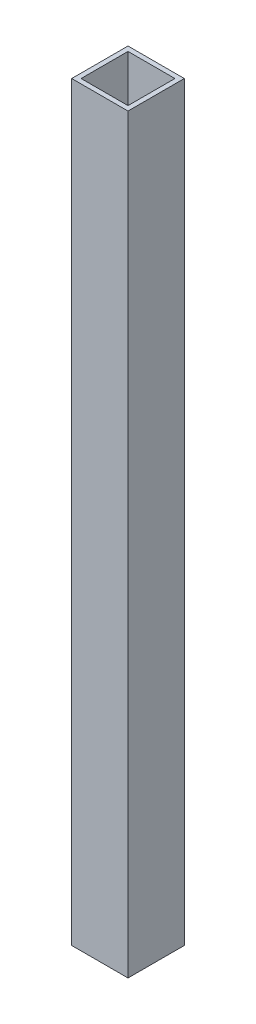
from build123d import *

# Parameters (mm, degrees)
SKETCH1_W           = 19.05
SKETCH1_H           = 19.05
SKETCH1_W_2         = 15.875
SKETCH1_H_2         = 15.875
EXTRUDE_THIN1_DEPTH = 254


with BuildPart() as part:
    # Sketch1 → Extrude-Thin1 (new body)
    with BuildSketch(Plane(origin=(0, 0, 0), x_dir=(1, 0, 0), z_dir=(0, 1, 0))):
        with Locations((9.525, 9.525)):
            Rectangle(SKETCH1_W, SKETCH1_H)
        with Locations((9.525, 9.525)):
            Rectangle(SKETCH1_W_2, SKETCH1_H_2, mode=Mode.SUBTRACT)
    extrude(amount=EXTRUDE_THIN1_DEPTH)


solid = part.part
